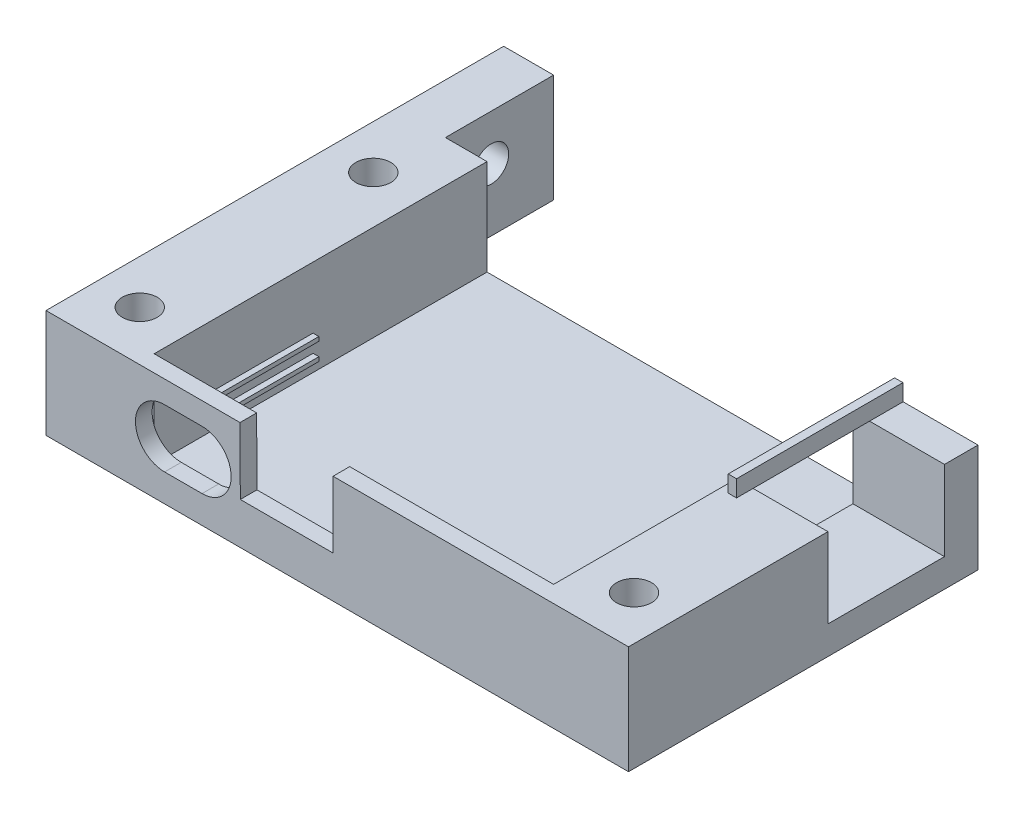
from build123d import *

# Parameters (mm, degrees)
SKETCH_1_W          = 11
SKETCH_1_H          = 40
EXTRUDE_1_DEPTH     = 13
SKETCH_2_W          = 40
SKETCH_2_H          = 1.5
EXTRUDE_2_DEPTH     = 48
SKETCH_3_W          = 12
SKETCH_3_H          = 0.5
EXTRUDE_3_DEPTH     = 0.7
SKETCH_4_W          = 20
SKETCH_4_H          = 0.495112862
EXTRUDE_4_DEPTH     = 0.7
CUT_EXTRUDE_1_DEPTH = 6
SKETCH_10_R         = 2.1
CUT_EXTRUDE_2_DEPTH = 9
CUT_EXTRUDE_3_DEPTH = 2
CUT_EXTRUDE_4_DEPTH = 2
SKETCH_17_W         = 1
SKETCH_17_H         = 20
EXTRUDE_6_DEPTH     = 2
SKETCH_21_W         = 6
SKETCH_21_H         = 13
EXTRUDE_8_DEPTH     = 13
SKETCH_23_R         = 2.1
CUT_EXTRUDE_7_DEPTH = 6
SKETCH_25_W         = 14
SKETCH_25_H         = 9.6
CUT_EXTRUDE_8_DEPTH = 11


with BuildPart() as part:
    # 草图1 → 凸台-拉伸1 (new body)
    with BuildSketch(Plane(origin=(0, 0, 0), x_dir=(1, 0, 0), z_dir=(0, 1, 0))):
        with Locations((-36.060761024, 1.454759243)):
            Rectangle(SKETCH_1_W, SKETCH_1_H)
        Polygon((17.439238976, -18.545240757), (-30.560761024, -18.545240757), (-41.560761024, -18.545240757), (-41.560761024, -20.545240757), (28.439238976, -20.545240757), (28.439238976, -18.545240757), align=None)
        with Locations((22.939238976, 1.454759243)):
            Rectangle(SKETCH_1_W, SKETCH_1_H)
    extrude(amount=EXTRUDE_1_DEPTH)

    # 草图2 → 凸台-拉伸2 (add)
    with BuildSketch(Plane(origin=(-30.560761024, 0, 0), x_dir=(0, 0, -1), z_dir=(1, 0, 0))):
        with Locations((1.454759243, 0.75)):
            Rectangle(SKETCH_2_W, SKETCH_2_H)
    extrude(amount=EXTRUDE_2_DEPTH)

    # 草图3 → 凸台-拉伸3 (add)
    with BuildSketch(Plane(origin=(-30.560761024, 0, 0), x_dir=(0, 0, -1), z_dir=(1, 0, 0))):
        with Locations((-5.453399323, 5.35)):
            Rectangle(SKETCH_3_W, SKETCH_3_H)
        with Locations((-5.453399323, 3.25)):
            Rectangle(SKETCH_3_W, SKETCH_3_H)
    extrude(amount=EXTRUDE_3_DEPTH)

    # 草图4 → 凸台-拉伸4 (add)
    with BuildSketch(Plane.ZY.offset(-17.439238976)):
        with Locations((8.545240757, 3.152443569)):
            Rectangle(SKETCH_4_W, SKETCH_4_H)
        with Locations((8.545240757, 5.247556431)):
            Rectangle(SKETCH_4_W, SKETCH_4_H)
    extrude(amount=EXTRUDE_4_DEPTH)

    # 草图5 → 切除-拉伸1 (cut)
    with BuildSketch(Plane(origin=(0, 0, 0), x_dir=(-1, 0, 0), z_dir=(0, -1, 0))):
        Polygon((-27.439238976, -12.097422285), (-27.439238976, -17.0626346), (-23.139238976, -19.545240757), (-18.839238976, -17.0626346), (-18.839238976, -12.097422285), (-23.139238976, -9.614816127), align=None)
        Polygon((31.960761024, -12.097422285), (31.960761024, -17.0626346), (36.260761024, -19.545240757), (40.560761024, -17.0626346), (40.560761024, -12.097422285), (36.260761024, -9.614816127), align=None)
        Polygon((31.960761024, 15.972153085), (31.960761024, 11.00694077), (36.260761024, 8.524334613), (40.560761024, 11.00694077), (40.560761024, 15.972153085), (36.260761024, 18.454759243), align=None)
    extrude(amount=-CUT_EXTRUDE_1_DEPTH, mode=Mode.SUBTRACT)

    # 草图10 → 切除-拉伸2 (cut)
    with BuildSketch(Plane.XZ.offset(-6)):
        with BuildLine():
            ThreePointArc((-34.160761024, -13.489546928), (-34.775836783, -12.004622687), (-36.260761024, -11.389546928))
            Line((-36.260761024, -11.389546928), (-36.260761024, -15.589546928))
            ThreePointArc((-36.260761024, -15.589546928), (-34.775836783, -14.974471168), (-34.160761024, -13.489546928))
        make_face()
        with BuildLine():
            Line((-36.260761024, -15.589546928), (-36.260761024, -11.389546928))
            ThreePointArc((-36.260761024, -11.389546928), (-38.360761024, -13.489546928), (-36.260761024, -15.589546928))
        make_face()
        with BuildLine():
            ThreePointArc((-34.160761024, 14.580028442), (-34.775836783, 16.064952683), (-36.260761024, 16.680028442))
            Line((-36.260761024, 16.680028442), (-36.260761024, 12.480028442))
            ThreePointArc((-36.260761024, 12.480028442), (-34.775836783, 13.095104202), (-34.160761024, 14.580028442))
        make_face()
        with BuildLine():
            Line((-36.260761024, 12.480028442), (-36.260761024, 16.680028442))
            ThreePointArc((-36.260761024, 16.680028442), (-38.360761024, 14.580028442), (-36.260761024, 12.480028442))
        make_face()
        with Locations(Location((23.139238976, 14.580028442, 0), (0, 0, 270))):
            Circle(SKETCH_10_R)
    extrude(amount=-CUT_EXTRUDE_2_DEPTH, mode=Mode.SUBTRACT)

    # 草图12 → 切除-拉伸3 (cut)
    with BuildSketch(Plane.XY.offset(20.545240757)):
        with BuildLine():
            Line((-27.310761024, 3.325), (-22.810761024, 3.325))
            ThreePointArc((-22.810761024, 3.325), (-19.310761024, 6.825), (-22.810761024, 10.325))
            Line((-22.810761024, 10.325), (-27.310761024, 10.325))
            ThreePointArc((-27.310761024, 10.325), (-30.810761024, 6.825), (-27.310761024, 3.325))
        make_face()
    extrude(amount=-CUT_EXTRUDE_3_DEPTH, mode=Mode.SUBTRACT)

    # 草图13 → 切除-拉伸4 (cut)
    with BuildSketch(Plane.XY.offset(20.545240757)):
        Polygon((-18.245761024, 13), (-18.210761024, 5.01), (-7.063003257, 5.01), (-7.065761024, 13), align=None)
    extrude(amount=-CUT_EXTRUDE_4_DEPTH, mode=Mode.SUBTRACT)

    # 草图17 → 凸台-拉伸6 (add)
    with BuildSketch(Plane(origin=(0, 13, 0), x_dir=(1, 0, 0), z_dir=(0, 1, 0))):
        with Locations((18.939238976, 11.439097948)):
            Rectangle(SKETCH_17_W, SKETCH_17_H)
    extrude(amount=EXTRUDE_6_DEPTH)

    # 草图21 → 凸台-拉伸8 (add)
    with BuildSketch(Plane(origin=(0, 0, -21.454759243), x_dir=(-1, 0, 0), z_dir=(0, 0, -1))):
        with Locations((38.560761024, 6.5)):
            Rectangle(SKETCH_21_W, SKETCH_21_H)
    extrude(amount=EXTRUDE_8_DEPTH)

    # 草图23 → 切除-拉伸7 (cut)
    with BuildSketch(Plane(origin=(-35.560761024, 0, 0), x_dir=(0, 0, -1), z_dir=(1, 0, 0))):
        with Locations((26.954759243, 7.5)):
            Circle(SKETCH_23_R)
    extrude(amount=-CUT_EXTRUDE_7_DEPTH, mode=Mode.SUBTRACT)

    # 草图25 → 切除-拉伸8 (cut)
    with BuildSketch(Plane(origin=(28.439238976, 0, 0), x_dir=(0, 0, -1), z_dir=(1, 0, 0))):
        with Locations((10.424759243, 8.2)):
            Rectangle(SKETCH_25_W, SKETCH_25_H)
    extrude(amount=-CUT_EXTRUDE_8_DEPTH, mode=Mode.SUBTRACT)


solid = part.part
